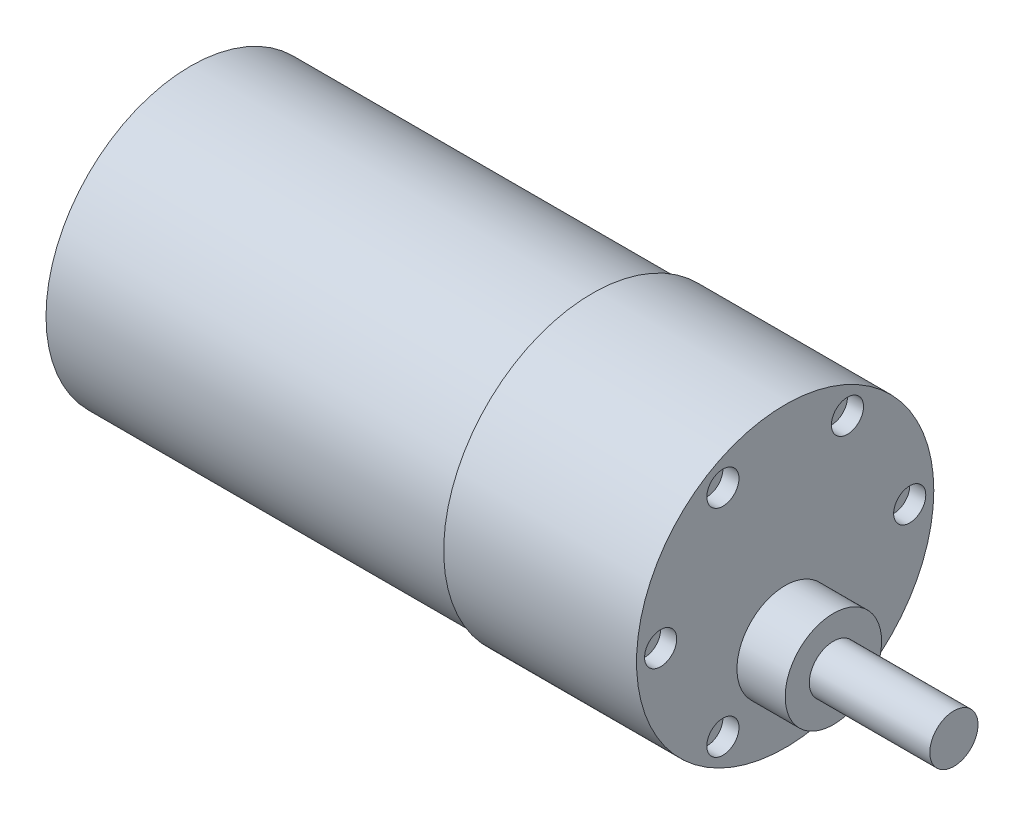
from build123d import *

# Parameters (mm, degrees)
SKETCH1_R           = 18.5
BOSS_EXTRUDE1_DEPTH = 24
SKETCH2_R           = 18
BOSS_EXTRUDE2_DEPTH = 50
SKETCH3_R           = 6
BOSS_EXTRUDE3_DEPTH = 6
SKETCH4_R           = 3
BOSS_EXTRUDE4_DEPTH = 15
SKETCH5_R           = 2
CUT_EXTRUDE1_DEPTH  = 2


with BuildPart() as part:
    # Sketch1 → Boss-Extrude1 (new body)
    with BuildSketch(Plane(origin=(0, 0, 0), x_dir=(0, 0, -1), z_dir=(1, 0, 0))):
        Circle(SKETCH1_R)
    extrude(amount=-BOSS_EXTRUDE1_DEPTH)

    # Sketch2 → Boss-Extrude2 (add)
    with BuildSketch(Plane.ZY.offset(24)):
        Circle(SKETCH2_R)
    extrude(amount=BOSS_EXTRUDE2_DEPTH)

    # Sketch3 → Boss-Extrude3 (add)
    with BuildSketch(Plane(origin=(0, 0, 0), x_dir=(0, 0, -1), z_dir=(1, 0, 0))):
        with Locations((0, -7)):
            Circle(SKETCH3_R)
    extrude(amount=BOSS_EXTRUDE3_DEPTH)

    # Sketch4 → Boss-Extrude4 (add)
    with BuildSketch(Plane(origin=(6, 0, 0), x_dir=(0, 0, -1), z_dir=(1, 0, 0))):
        with Locations((0, -7)):
            Circle(SKETCH4_R)
    extrude(amount=BOSS_EXTRUDE4_DEPTH)

    # Sketch5 → Cut-Extrude1 (cut)
    with BuildSketch(Plane(origin=(0, 0, 0), x_dir=(0, 0, -1), z_dir=(1, 0, 0))):
        with Locations((-15.5, 0)):
            Circle(SKETCH5_R)
        with Locations((-7.75, 13.423393759)):
            Circle(SKETCH5_R)
        with Locations((7.75, 13.423393759)):
            Circle(SKETCH5_R)
        with Locations((15.5, 0)):
            Circle(SKETCH5_R)
        with Locations((7.75, -13.423393759)):
            Circle(SKETCH5_R)
        with Locations((-7.75, -13.423393759)):
            Circle(SKETCH5_R)
    extrude(amount=-CUT_EXTRUDE1_DEPTH, mode=Mode.SUBTRACT)


solid = part.part
